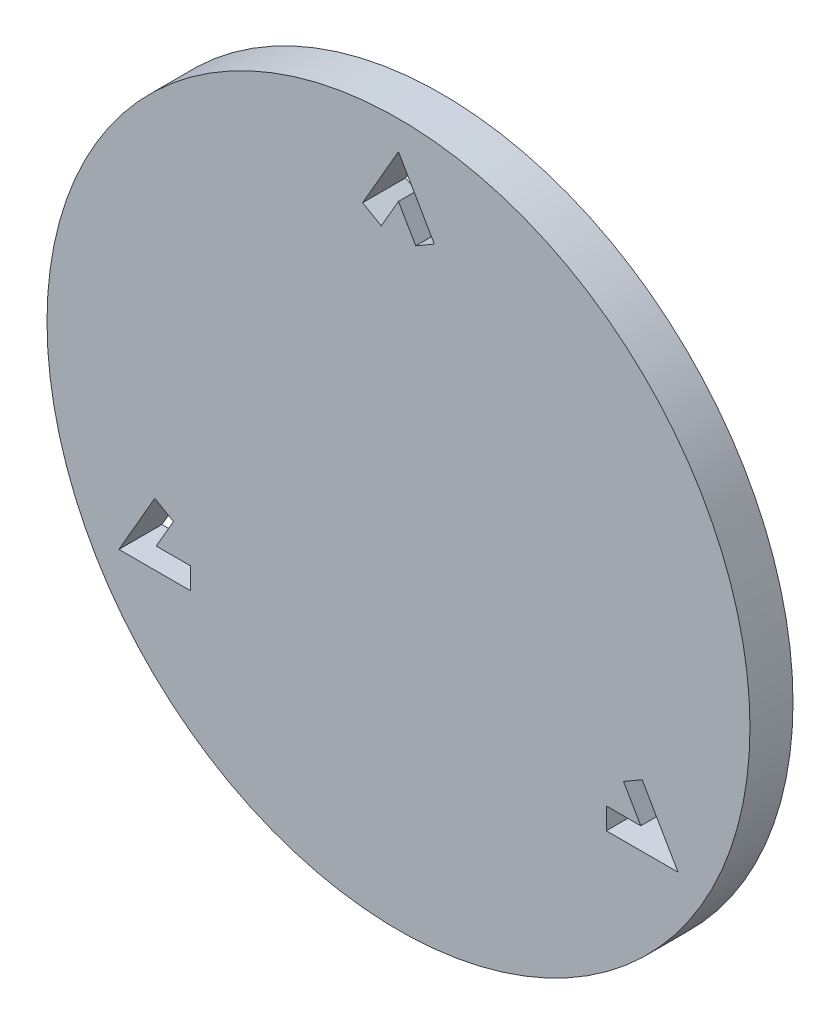
from build123d import *

# Parameters (mm, degrees)
CROQUIS1_R              = 49
SALIENTE_EXTRUIR1_DEPTH = 6


with BuildPart() as part:
    # Croquis1 → Saliente-Extruir1 (new body)
    # profile 1 of 2: a face of its own
    with BuildSketch(Plane.XY):
        Circle(CROQUIS1_R)
        Polygon((-5, 36.339745962), (0, 45), (5, 36.339745962), (33.97114317, -13.839745962), (38.97114317, -22.5), (28.97114317, -22.5), (-28.97114317, -22.5), (-38.97114317, -22.5), (-33.97114317, -13.839745962), align=None, mode=Mode.SUBTRACT)
    # profile 2 of 2: a face of its own
    with BuildSketch(Plane.XY):
        Polygon((-2.401923789, 34.839745962), (-5, 36.339745962), (-33.97114317, -13.839745962), (-31.373066959, -15.339745962), (-33.774990748, -19.5), (-28.97114317, -19.5), (-28.97114317, -22.5), (28.97114317, -22.5), (28.97114317, -19.5), (33.774990748, -19.5), (31.373066959, -15.339745962), (33.97114317, -13.839745962), (5, 36.339745962), (2.401923789, 34.839745962), (0, 39), align=None)
    extrude(amount=SALIENTE_EXTRUIR1_DEPTH)


solid = part.part
